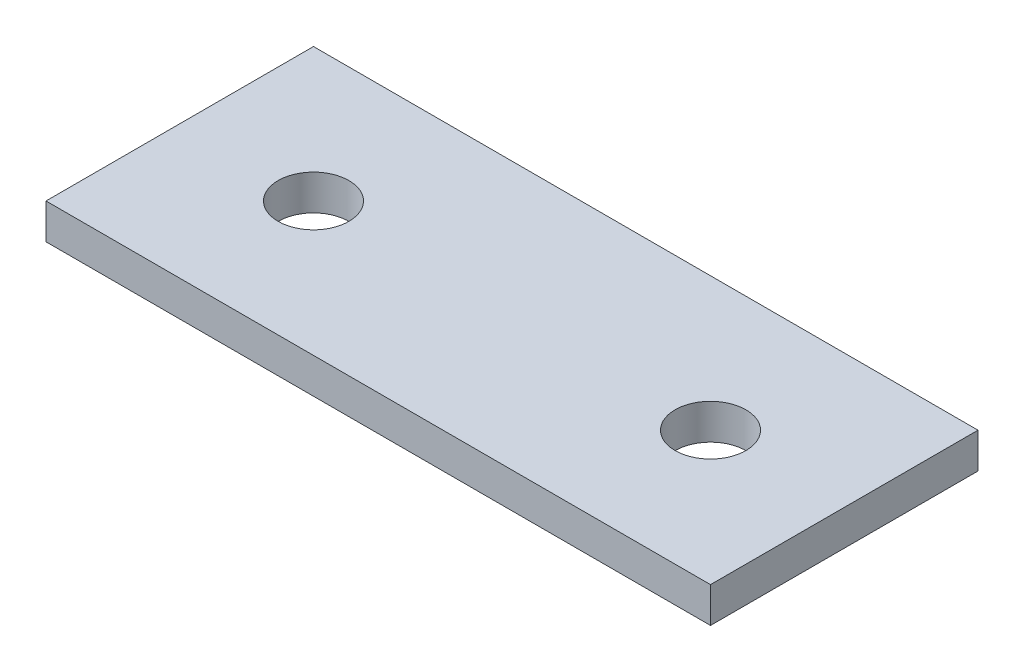
from build123d import *

# Parameters (mm, degrees)
SKETCH1_W           = 29.81
SKETCH1_H           = 12
SKETCH1_R           = 1.5875
BOSS_EXTRUDE1_DEPTH = 0.79375


with BuildPart() as part:
    # Sketch1 → Boss-Extrude1 (new, symmetric)
    with BuildSketch(Plane(origin=(0, 0, 0), x_dir=(1, 0, 0), z_dir=(0, 1, 0))):
        Rectangle(SKETCH1_W, SKETCH1_H)
        with Locations(Location((-8.905, 0, 0), (0, 0, 270))):
            Circle(SKETCH1_R, mode=Mode.SUBTRACT)
        with Locations(Location((8.905, 0, 0), (0, 0, 270))):
            Circle(SKETCH1_R, mode=Mode.SUBTRACT)
    extrude(amount=BOSS_EXTRUDE1_DEPTH, both=True)


solid = part.part
